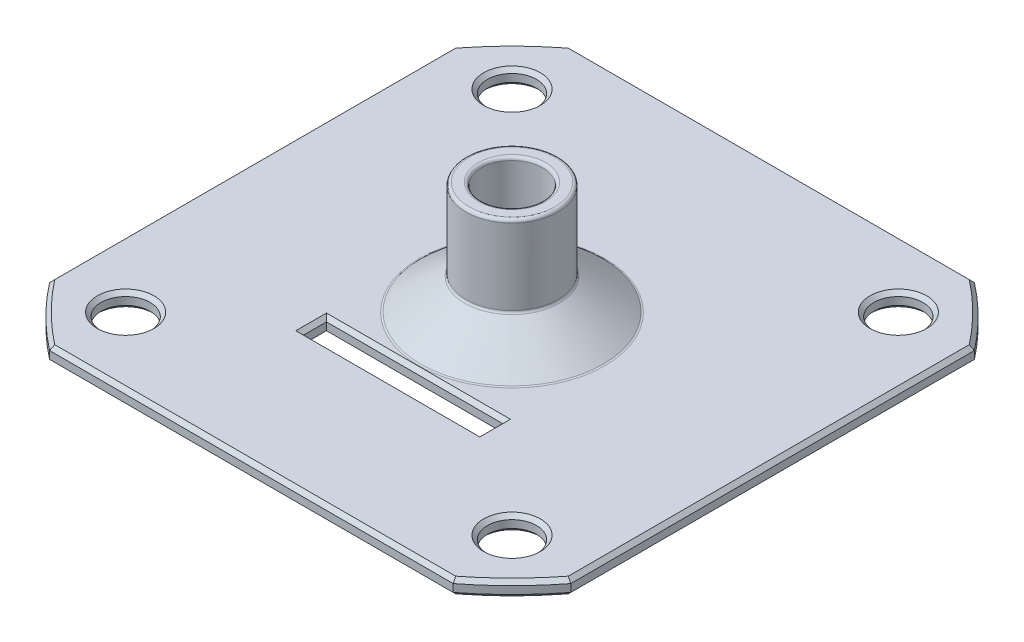
from build123d import *

# Parameters (mm, degrees)
BOSS_EXTRUDE1_START = 1
SKETCH2_R           = 1.6
SKETCH2_W           = 11.5
SKETCH2_H           = 1.5
SKETCH2_R_2         = 6
BOSS_EXTRUDE1_DEPTH = 1
FILLET1_R           = 0.2
CHAMFER1_SIZE       = 0.25


with BuildPart() as part:
    # Sketch1 → Revolve1 (revolve)
    with BuildSketch(Plane(origin=(0, 0, 0), x_dir=(0, 0, -1), z_dir=(1, 0, 0))):
        Polygon((3, 8.35), (2, 8.35), (2, 5.2), (0, 5.2), (0, 4.590857935), (5.128276602, 1), (5.128276602, 0), (6, 0), (6, 1), (3, 3.100622615), align=None)
    revolve(axis=Axis((0, 0, 0), (0, 1, 0)))

    # Sketch2 → Boss-Extrude1 (add)
    with BuildSketch(Plane(origin=(0, 0, 0), x_dir=(1, 0, 0), z_dir=(0, 1, 0)).offset(BOSS_EXTRUDE1_START)):
        with BuildLine():
            Line((17, -13.162446581), (17, 13.162446581))
            ThreePointArc((17, 13.162446581), (15.202795796, 15.202795796), (13.162446581, 17))
            Line((13.162446581, 17), (-13.162446581, 17))
            ThreePointArc((-13.162446581, 17), (-15.202795796, 15.202795796), (-17, 13.162446581))
            Line((-17, 13.162446581), (-17, -13.162446581))
            ThreePointArc((-17, -13.162446581), (-15.202795796, -15.202795796), (-13.162446581, -17))
            Line((-13.162446581, -17), (13.162446581, -17))
            ThreePointArc((13.162446581, -17), (15.202795796, -15.202795796), (17, -13.162446581))
        make_face()
        with Locations((-12.600642841, -12.600642841)):
            Circle(SKETCH2_R, mode=Mode.SUBTRACT)
        with Locations((12.600642841, -12.600642841)):
            Circle(SKETCH2_R, mode=Mode.SUBTRACT)
        with Locations((0, -7.1)):
            Rectangle(SKETCH2_W, SKETCH2_H, mode=Mode.SUBTRACT)
        with Locations((-12.600642841, 12.600642841)):
            Circle(SKETCH2_R, mode=Mode.SUBTRACT)
        Circle(SKETCH2_R_2, mode=Mode.SUBTRACT)
        with Locations((12.600642841, 12.600642841)):
            Circle(SKETCH2_R, mode=Mode.SUBTRACT)
    extrude(amount=-BOSS_EXTRUDE1_DEPTH)

    # Fillet1
    fillet1_edges = [part.edges().sort_by_distance(p)[0] for p in [
        (0, 8.35, 2),
        (0, 8.35, 3),
        (0, 5.2, 2),
        (0, 1, 5.128276602),
        (0, 3.100622615, 3),
        (0, 1, 6),
    ]]
    fillet(fillet1_edges, radius=FILLET1_R)

    # Chamfer1
    chamfer1_edges = [part.edges().sort_by_distance(p)[0] for p in [
        (0, 0, 5.128276602),
        (15.202795796, 0, 15.202795796),
        (17, 0, 0),
        (15.202795796, 0, -15.202795796),
        (0, 0, -17),
        (-15.202795796, 0, -15.202795796),
        (-17, 0, 0),
        (-15.202795796, 0, 15.202795796),
        (0, 0, 17),
        (5.75, 0, 7.1),
        (0, 0, 7.85),
        (-5.75, 0, 7.1),
        (0, 0, 6.35),
        (11.000642841, 0, -12.600642841),
        (11.000642841, 0, 12.600642841),
        (-14.200642841, 0, 12.600642841),
        (-14.200642841, 0, -12.600642841),
        (-15.202795796, 1, 15.202795796),
        (-17, 1, 0),
        (-15.202795796, 1, -15.202795796),
        (0, 1, -17),
        (15.202795796, 1, -15.202795796),
        (17, 1, 0),
        (15.202795796, 1, 15.202795796),
        (0, 1, 17),
        (-5.75, 1, 7.1),
        (0, 1, 7.85),
        (5.75, 1, 7.1),
        (0, 1, 6.35),
        (11.000642841, 1, -12.600642841),
        (11.000642841, 1, 12.600642841),
        (-14.200642841, 1, 12.600642841),
        (-14.200642841, 1, -12.600642841),
    ]]
    chamfer(chamfer1_edges, length=CHAMFER1_SIZE)


solid = part.part
